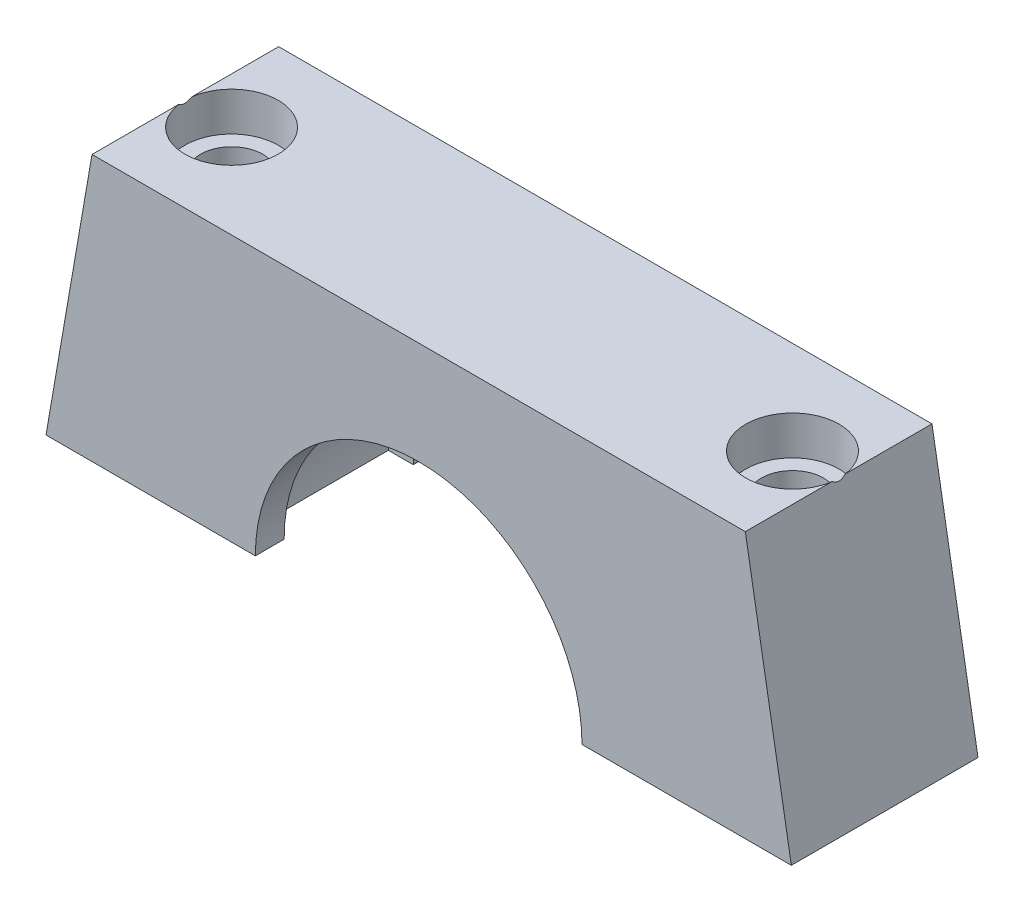
from build123d import *

# Parameters (mm, degrees)
ESTRUSIONE_ESTRUSIONE1_DEPTH = 12
SCHIZZO2_R                   = 2
TAGLIO_ESTRUSIONE1_DEPTH     = 32.786381776
SCHIZZO3_R                   = 3
TAGLIO_ESTRUSIONE2_DEPTH     = 2.5
ESTRUSIONE_ESTRUSIONE2_START = -1.85
ESTRUSIONE_ESTRUSIONE2_DEPTH = 1.85
ESTRUSIONE_ESTRUSIONE3_DEPTH = 1.85


with BuildPart() as part:
    # Schizzo1 → Estrusione-Estrusione1 (new body)
    with BuildSketch(Plane.XY):
        with BuildLine():
            Line((21, 17.1), (-21, 17.1))
            Line((-21, 17.1), (-21, 0))
            Line((-21, 0), (-12.1, 0))
            ThreePointArc((-12.1, 0), (0, 12.1), (12.1, 0))
            Line((12.1, 0), (21, 0))
            Line((21, 0), (21, 17.1))
        make_face()
        Polygon((-21, 17.1), (-23.95754717, 0), (-21, 0), align=None)
        Polygon((21, 0), (23.95754717, 0), (21, 17.1), align=None)
    extrude(amount=ESTRUSIONE_ESTRUSIONE1_DEPTH)

    # Schizzo2 → Taglio-Estrusione1 (cut, through all)
    with BuildSketch(Plane.XZ):
        with Locations((-18.028773585, 6)):
            Circle(SCHIZZO2_R)
        with Locations((18.028773585, 6)):
            Circle(SCHIZZO2_R)
    extrude(amount=-TAGLIO_ESTRUSIONE1_DEPTH, mode=Mode.SUBTRACT)

    # Schizzo3 → Taglio-Estrusione2 (cut)
    with BuildSketch(Plane(origin=(0, 17.1, 0), x_dir=(1, 0, 0), z_dir=(0, 1, 0))):
        with Locations(Location((-18.028773585, -6, 0), (0, 0, 180))):
            Circle(SCHIZZO3_R)
        with Locations(Location((18.028773585, -6, 0), (0, 0, 180))):
            Circle(SCHIZZO3_R)
    extrude(amount=-TAGLIO_ESTRUSIONE2_DEPTH, mode=Mode.SUBTRACT)

    # Schizzo4 → Estrusione-Estrusione2 (add)
    with BuildSketch(Plane.XY.offset(12).offset(ESTRUSIONE_ESTRUSIONE2_START)):
        with BuildLine():
            ThreePointArc((-10.5, 0), (0, 10.5), (10.5, 0))
            Line((10.5, 0), (12.1, 0))
            ThreePointArc((12.1, 0), (0, 12.1), (-12.1, 0))
            Line((-12.1, 0), (-10.5, 0))
        make_face()
    extrude(amount=ESTRUSIONE_ESTRUSIONE2_DEPTH)

    # Schizzo5 → Estrusione-Estrusione3 (add)
    with BuildSketch(Plane(origin=(0, 0, 0), x_dir=(-1, 0, 0), z_dir=(0, 0, -1))):
        with BuildLine():
            Line((10.5, 0), (12.1, 0))
            ThreePointArc((12.1, 0), (0, 12.1), (-12.1, 0))
            Line((-12.1, 0), (-10.5, 0))
            ThreePointArc((-10.5, 0), (0, 10.5), (10.5, 0))
        make_face()
    extrude(amount=-ESTRUSIONE_ESTRUSIONE3_DEPTH)


solid = part.part
